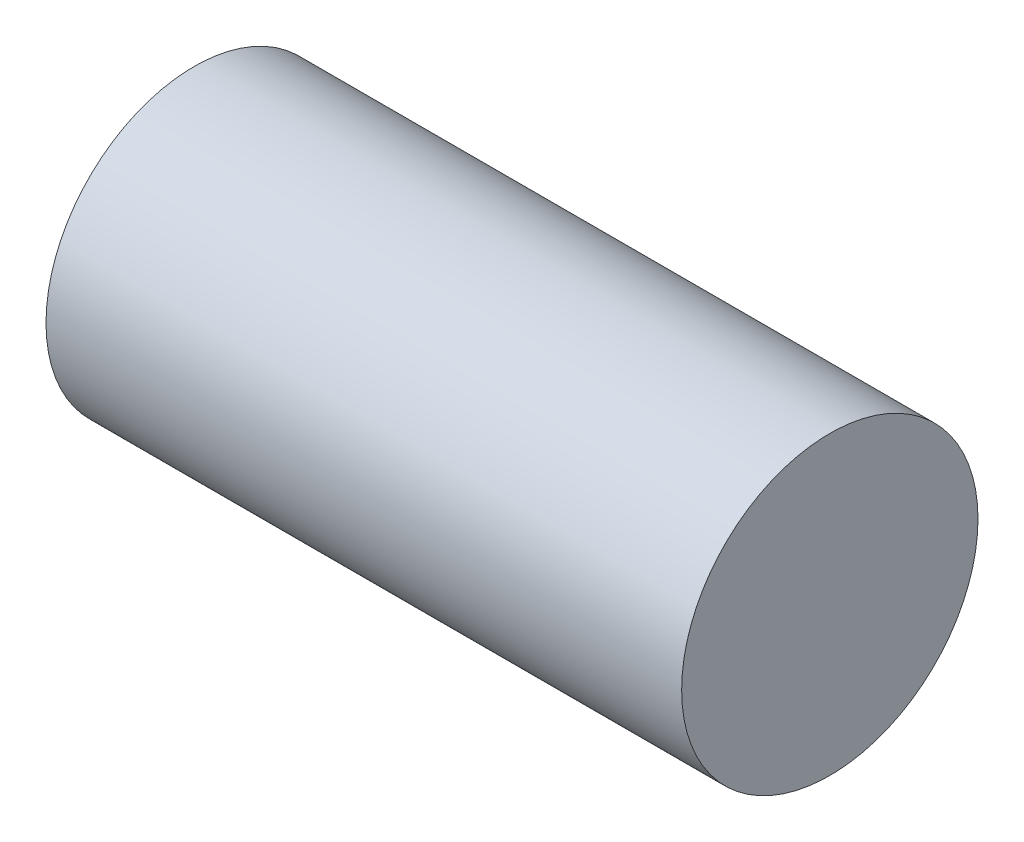
from build123d import *

# Parameters (mm, degrees)
CURVESKETCH_R   = 7.919
CURVEBOSS_DEPTH = 16.9855


with BuildPart() as part:
    # CurveSketch → CurveBoss (new, symmetric)
    with BuildSketch(Plane(origin=(0, 0, 0), x_dir=(0, 0, -1), z_dir=(1, 0, 0))):
        with Locations((4.971, -9.313)):
            Circle(CURVESKETCH_R)
    extrude(amount=CURVEBOSS_DEPTH, both=True)


solid = part.part
